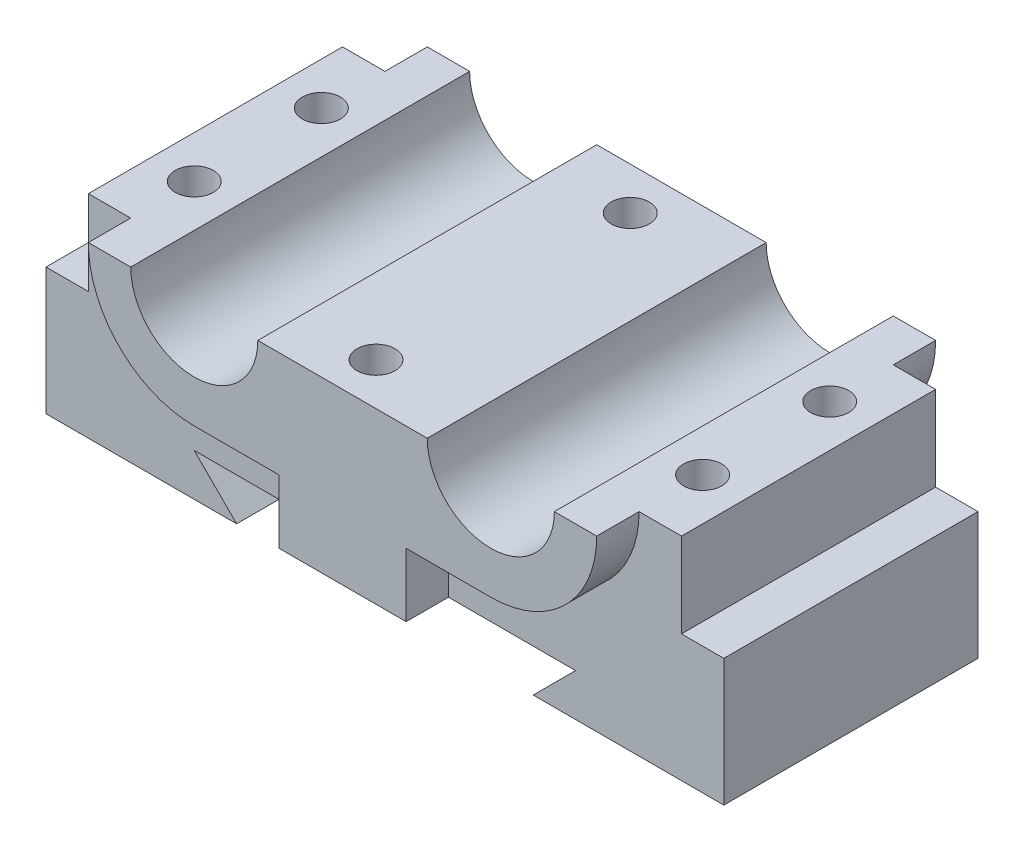
from build123d import *

# Parameters (mm, degrees)
BOSS_EXTRUDE1_DEPTH            = 20
BOSS_EXTRUDE2_DEPTH            = 15
F_1_0MM_DOWEL_HOLE1_AT_2_COUNT = 2
F_1_0MM_DOWEL_HOLE1_AT_2_PITCH = 31.941060089
F_1_0MM_DOWEL_HOLE1_AT_3_COUNT = 2
F_1_0MM_DOWEL_HOLE1_AT_3_PITCH = 29.907615952


with BuildPart() as part:
    # Sketch1 → Boss-Extrude1 (new, symmetric)
    with BuildSketch(Plane.XY):
        with BuildLine():
            Line((-23.598593643, 12.5), (-23.598593643, 5))
            Line((-23.598593643, 5), (-8.598593643, 5))
            Line((-8.598593643, 5), (-8.598593643, 12.5))
            Line((-8.598593643, 12.5), (1.401406357, 12.5))
            ThreePointArc((1.401406357, 12.5), (10.240241122, 16.161165235), (13.901406357, 25))
            Line((13.901406357, 25), (8.901406357, 25))
            ThreePointArc((8.901406357, 25), (1.401406357, 17.5), (-6.098593643, 25))
            Line((-6.098593643, 25), (-26.098593643, 25))
            ThreePointArc((-26.098593643, 25), (-33.598593643, 17.5), (-41.098593643, 25))
            Line((-41.098593643, 25), (-46.098593643, 25))
            ThreePointArc((-46.098593643, 25), (-42.437428408, 16.161165235), (-33.598593643, 12.5))
            Line((-33.598593643, 12.5), (-23.598593643, 12.5))
        make_face()
    extrude(amount=BOSS_EXTRUDE1_DEPTH, both=True)

    # Sketch1<3> → Boss-Extrude2 (add, symmetric)
    with BuildSketch(Plane.XY):
        with BuildLine():
            Line((-56.098593643, 15), (-56.098593643, 0))
            Line((-56.098593643, 0), (-33.598593643, 0))
            Line((-33.598593643, 0), (-38.598593643, 5))
            Line((-38.598593643, 5), (-23.598593643, 5))
            Line((-23.598593643, 5), (-23.598593643, 12.5))
            Line((-23.598593643, 12.5), (-33.598593643, 12.5))
            ThreePointArc((-33.598593643, 12.5), (-42.437428408, 16.161165235), (-46.098593643, 25))
            Line((-46.098593643, 25), (-51.098593643, 25))
            Line((-51.098593643, 25), (-51.098593643, 15))
            Line((-51.098593643, 15), (-56.098593643, 15))
        make_face()
        with BuildLine():
            Line((-8.598593643, 12.5), (-8.598593643, 5))
            Line((-8.598593643, 5), (6.401406357, 5))
            Line((6.401406357, 5), (1.401406357, 0))
            Line((1.401406357, 0), (23.901406357, 0))
            Line((23.901406357, 0), (23.901406357, 15))
            Line((23.901406357, 15), (18.901406357, 15))
            Line((18.901406357, 15), (18.901406357, 25))
            Line((18.901406357, 25), (13.901406357, 25))
            ThreePointArc((13.901406357, 25), (10.240241122, 16.161165235), (1.401406357, 12.5))
            Line((1.401406357, 12.5), (-8.598593643, 12.5))
        make_face()
    extrude(amount=BOSS_EXTRUDE2_DEPTH, both=True)

    # Sketch4 → Ø1.0mm Dowel Hole1 (revolve, cut)
    with BuildSketch(Plane(origin=(-17.146642207, 25, -15), x_dir=(0, 0, 1), z_dir=(1, 0, 0))):
        Polygon((0, 0), (0, 16.299038106), (2.25, 15), (2.25, 0), align=None)
    f_1_0mm_dowel_hole1 = revolve(axis=Axis((-17.146642207, 31.35, -15), (0, -1, 0)), mode=Mode.SUBTRACT)

    # Ø1.0mm Dowel Hole1 at 2: Ø1.0mm Dowel Hole1 ×2
    with Locations(*[Vector(0.9720418945746677, 0, 0.23480748538258048) * (i * F_1_0MM_DOWEL_HOLE1_AT_2_PITCH) for i in range(1, F_1_0MM_DOWEL_HOLE1_AT_2_COUNT)]):
        add(f_1_0mm_dowel_hole1, mode=Mode.SUBTRACT)

    # Ø1.0mm Dowel Hole1 at 3: Ø1.0mm Dowel Hole1 ×2
    with Locations(*[Vector(-0.9680461151483998, 0, 0.25077224516698626) * (i * F_1_0MM_DOWEL_HOLE1_AT_3_PITCH) for i in range(1, F_1_0MM_DOWEL_HOLE1_AT_3_COUNT)]):
        add(f_1_0mm_dowel_hole1, mode=Mode.SUBTRACT)

    # Mirror1: Ø1.0mm Dowel Hole1 across plane
    add(f_1_0mm_dowel_hole1.mirror(Plane.XY), mode=Mode.SUBTRACT)

    # Mirror1 copy 1 sketch → Mirror1 copy 1 (revolve, cut)
    with BuildSketch(Plane(origin=(13.901406357, 25, 7.5), x_dir=(0, 0, -1), z_dir=(1, 0, 0))):
        Polygon((0, 0), (0, -16.299038106), (2.25, -15), (2.25, 0), align=None)
    revolve(axis=Axis((13.901406357, 31.35, 7.5), (0, 1, 0)), mode=Mode.SUBTRACT)

    # Mirror1 copy 2 sketch → Mirror1 copy 2 (revolve, cut)
    with BuildSketch(Plane(origin=(-46.098593643, 25, 7.5), x_dir=(0, 0, -1), z_dir=(1, 0, 0))):
        Polygon((0, 0), (0, -16.299038106), (2.25, -15), (2.25, 0), align=None)
    revolve(axis=Axis((-46.098593643, 31.35, 7.5), (0, 1, 0)), mode=Mode.SUBTRACT)


solid = part.part
